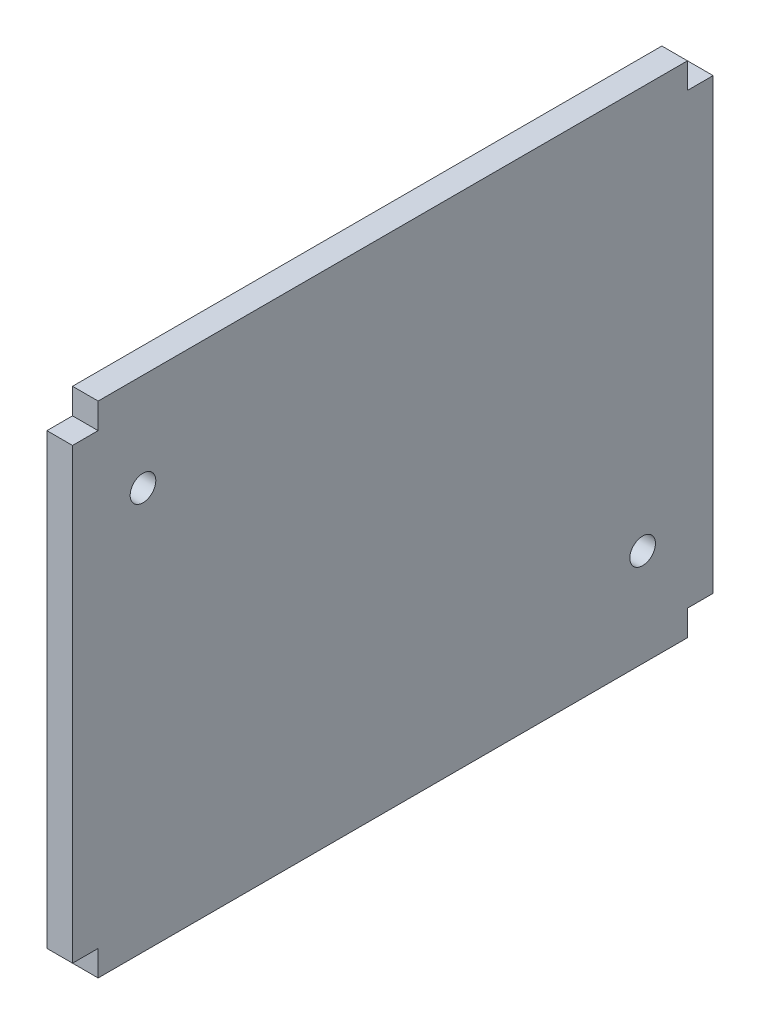
from build123d import *

# Parameters (mm, degrees)
BOSS_EXTRUDE1_DEPTH   = 4
F_4_0MM_DOWEL_HOLE1_D = 4


with BuildPart() as part:
    # Sketch1 → Boss-Extrude1 (new body)
    with BuildSketch(Plane(origin=(0, 0, 0), x_dir=(0, 0, -1), z_dir=(1, 0, 0))):
        Polygon((-46, 35), (-50, 35), (-50, 0), (0, 0), (0, 39), (-46, 39), align=None)
        Polygon((0, 39), (0, 0), (50, 0), (50, 35), (46, 35), (46, 39), align=None)
        Polygon((50, 0), (0, 0), (0, -39), (46, -39), (46, -35), (50, -35), align=None)
        Polygon((0, 0), (-50, 0), (-50, -35), (-46, -35), (-46, -39), (0, -39), align=None)
    extrude(amount=BOSS_EXTRUDE1_DEPTH)

    # Ø4.0mm Dowel Hole1 (through all)
    with Locations(Plane(origin=(0, -23.75, -39), x_dir=(0, 0, -1), z_dir=(-1, 0, 0))):
        with Locations((0, 0), (-78, -47.5)):
            Hole(F_4_0MM_DOWEL_HOLE1_D / 2)


solid = part.part
